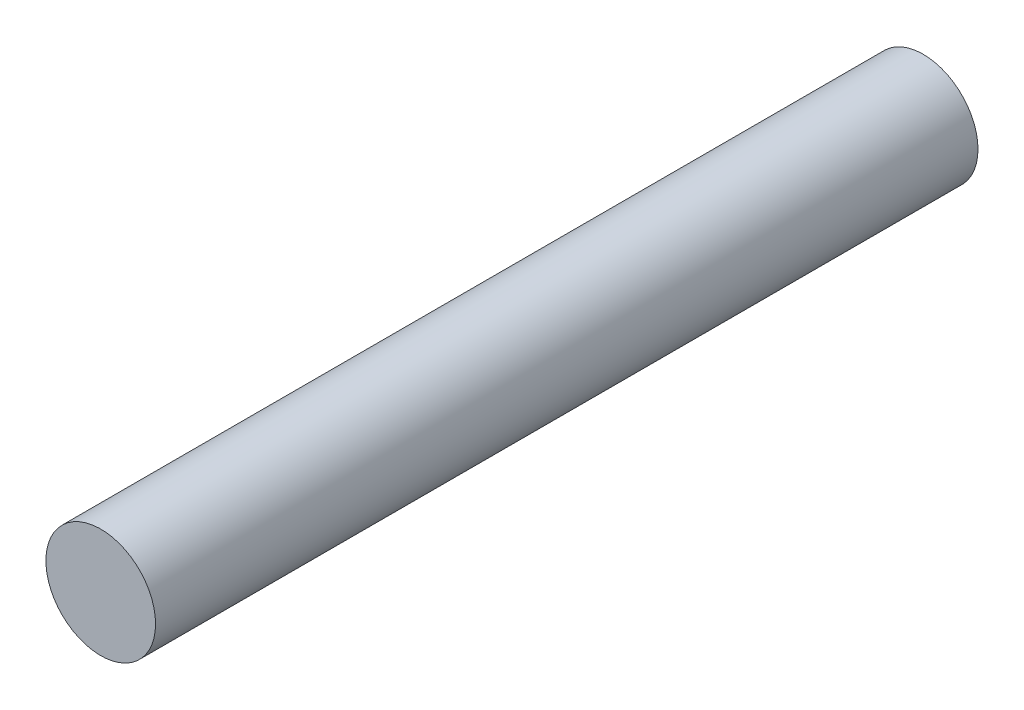
from build123d import *

# Parameters (mm, degrees)
SKETCH1_R           = 4
BOSS_EXTRUDE1_DEPTH = 60
CUT_EXTRUDE1_START  = -3
SKETCH2_W           = 8
SKETCH2_H           = 6
CUT_EXTRUDE1_DEPTH  = 1


with BuildPart() as part:
    # Sketch1 → Boss-Extrude1 (new body)
    with BuildSketch(Plane.XY):
        Circle(SKETCH1_R)
    extrude(amount=BOSS_EXTRUDE1_DEPTH)

    # Sketch2 → Cut-Extrude1 (cut)
    with BuildSketch(Plane(origin=(0, 0, 0), x_dir=(1, 0, 0), z_dir=(0, 1, 0)).offset(CUT_EXTRUDE1_START)):
        with Locations((0, -30)):
            Rectangle(SKETCH2_W, SKETCH2_H)
    extrude(amount=-CUT_EXTRUDE1_DEPTH, mode=Mode.SUBTRACT)


solid = part.part
